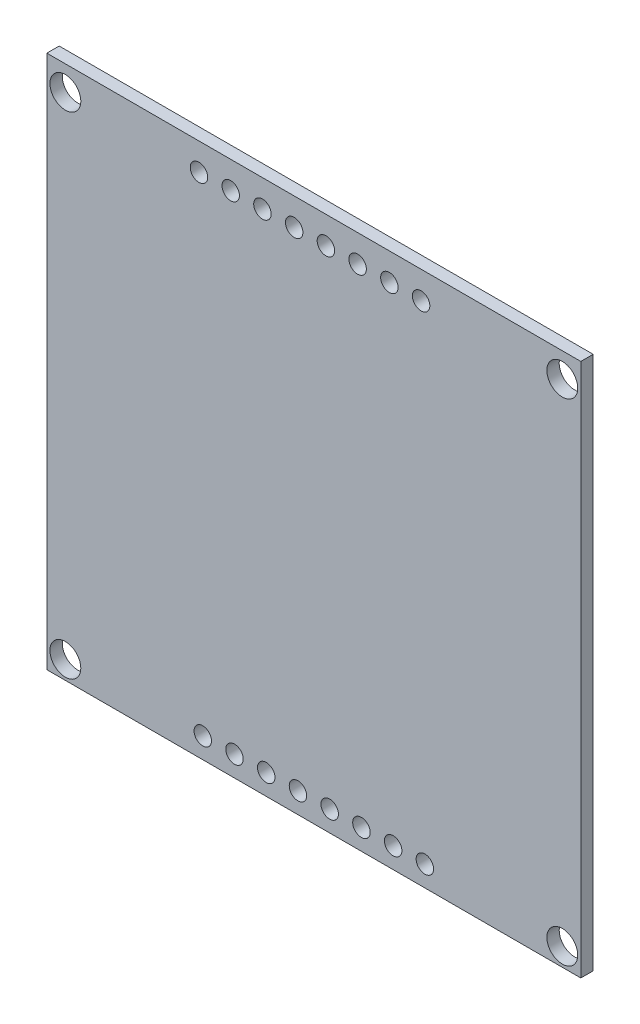
from build123d import *

# Parameters (mm, degrees)
ESBO_O1_W                = 43.25
ESBO_O1_H                = 43.25
ESBO_O1_R                = 1.25
ESBO_O1_R_2              = 0.707384329
RESSALTO_EXTRUS_O2_DEPTH = 1


with BuildPart() as part:
    # Esboço1 → Ressalto-extrusão2 (new body)
    with BuildSketch(Plane.XY):
        with Locations((21.625, 21.625)):
            Rectangle(ESBO_O1_W, ESBO_O1_H)
        with Locations(Location((1.5, 41.25, 0), (0, 0, 180))):
            Circle(ESBO_O1_R, mode=Mode.SUBTRACT)
        with Locations((12.322576567, 41.05)):
            Circle(ESBO_O1_R_2, mode=Mode.SUBTRACT)
        with Locations((41.75, 41.25)):
            Circle(ESBO_O1_R, mode=Mode.SUBTRACT)
        with Locations((14.892575201, 41.047350464)):
            Circle(ESBO_O1_R_2, mode=Mode.SUBTRACT)
        with Locations((17.462573835, 41.044700929)):
            Circle(ESBO_O1_R_2, mode=Mode.SUBTRACT)
        with Locations((20.03257247, 41.042051393)):
            Circle(ESBO_O1_R_2, mode=Mode.SUBTRACT)
        with Locations((22.602571104, 41.039401857)):
            Circle(ESBO_O1_R_2, mode=Mode.SUBTRACT)
        with Locations((25.172569738, 41.036752321)):
            Circle(ESBO_O1_R_2, mode=Mode.SUBTRACT)
        with Locations((27.742568372, 41.034102786)):
            Circle(ESBO_O1_R_2, mode=Mode.SUBTRACT)
        with Locations((30.312567007, 41.03145325)):
            Circle(ESBO_O1_R_2, mode=Mode.SUBTRACT)
        with Locations(Location((30.62, 1.67673648, 0), (0, 0, 180))):
            Circle(ESBO_O1_R_2, mode=Mode.SUBTRACT)
        with Locations(Location((28.05, 1.67673648, 0), (0, 0, 180))):
            Circle(ESBO_O1_R_2, mode=Mode.SUBTRACT)
        with Locations(Location((25.48, 1.67673648, 0), (0, 0, 180))):
            Circle(ESBO_O1_R_2, mode=Mode.SUBTRACT)
        with Locations(Location((22.91, 1.67673648, 0), (0, 0, 180))):
            Circle(ESBO_O1_R_2, mode=Mode.SUBTRACT)
        with Locations(Location((20.34, 1.67673648, 0), (0, 0, 180))):
            Circle(ESBO_O1_R_2, mode=Mode.SUBTRACT)
        with Locations(Location((17.77, 1.67673648, 0), (0, 0, 180))):
            Circle(ESBO_O1_R_2, mode=Mode.SUBTRACT)
        with Locations(Location((15.2, 1.67673648, 0), (0, 0, 180))):
            Circle(ESBO_O1_R_2, mode=Mode.SUBTRACT)
        with Locations(Location((41.75, 1.47673648, 0), (0, 0, 180))):
            Circle(ESBO_O1_R, mode=Mode.SUBTRACT)
        with Locations(Location((12.63, 1.67673648, 0), (0, 0, 180))):
            Circle(ESBO_O1_R_2, mode=Mode.SUBTRACT)
        with Locations((1.5, 1.47673648)):
            Circle(ESBO_O1_R, mode=Mode.SUBTRACT)
    extrude(amount=RESSALTO_EXTRUS_O2_DEPTH)


solid = part.part
